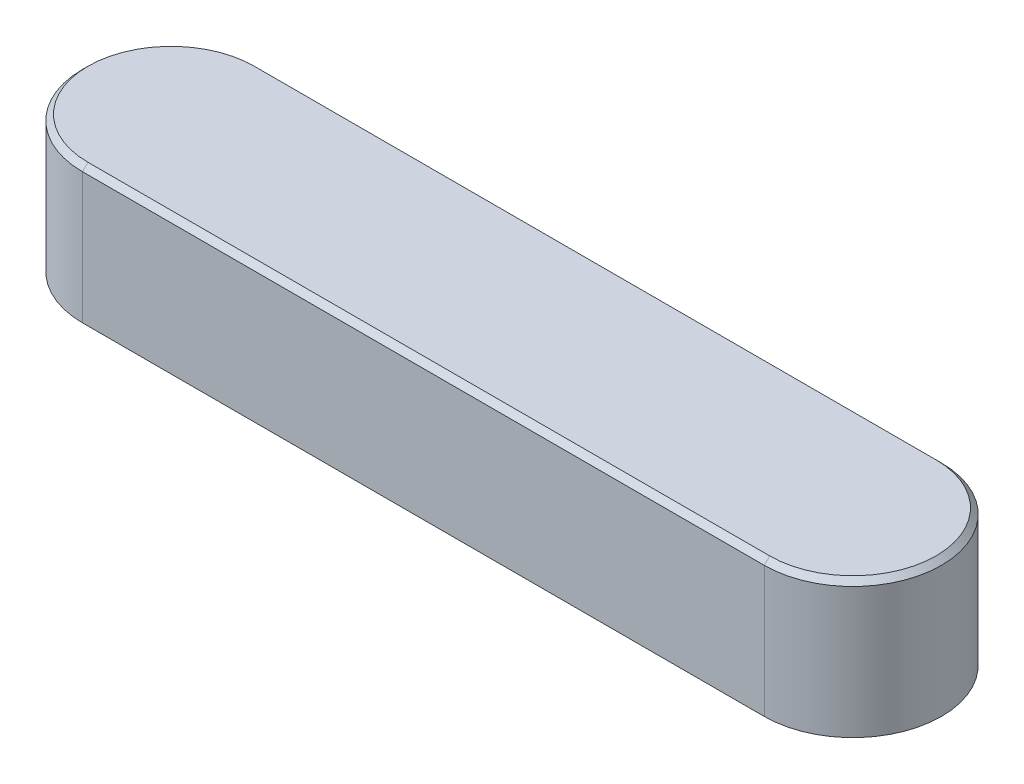
from build123d import *

# Parameters (mm, degrees)
BOSS_EXTRU_1_DEPTH = 5
CHANFREIN1_SIZE    = 0.2


with BuildPart() as part:
    # Esquisse2 → Boss.-Extru.1 (new body)
    with BuildSketch(Plane(origin=(0, 0, 0), x_dir=(1, 0, 0), z_dir=(0, 1, 0))):
        with BuildLine():
            Line((-8.641975309, 3.25), (16.358024691, 3.25))
            ThreePointArc((16.358024691, 3.25), (19.608024691, 0), (16.358024691, -3.25))
            Line((16.358024691, -3.25), (-8.641975309, -3.25))
            ThreePointArc((-8.641975309, -3.25), (-11.891975309, 0), (-8.641975309, 3.25))
        make_face()
    extrude(amount=BOSS_EXTRU_1_DEPTH)

    # Chanfrein1
    chanfrein1_edges = [part.edges().sort_by_distance(p)[0] for p in [
        (19.608024691, 5, 0),
        (3.858024691, 5, -3.25),
        (-11.891975309, 5, 0),
        (3.858024691, 5, 3.25),
    ]]
    chamfer(chanfrein1_edges, length=CHANFREIN1_SIZE)


solid = part.part
